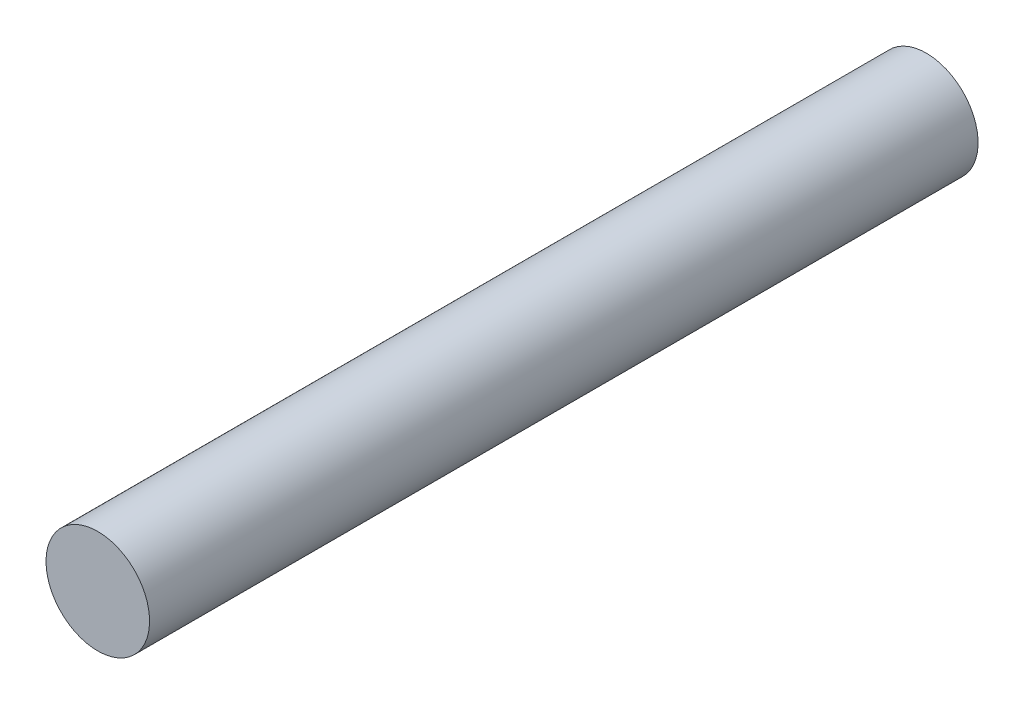
from build123d import *

# Parameters (mm, degrees)
SKETCH1_R           = 2.38125
BOSS_EXTRUDE1_DEPTH = 38.1


with BuildPart() as part:
    # Sketch1 → Boss-Extrude1 (new body)
    with BuildSketch(Plane.XY):
        with Locations((0, 4.365625)):
            Circle(SKETCH1_R)
    extrude(amount=BOSS_EXTRUDE1_DEPTH)


solid = part.part
